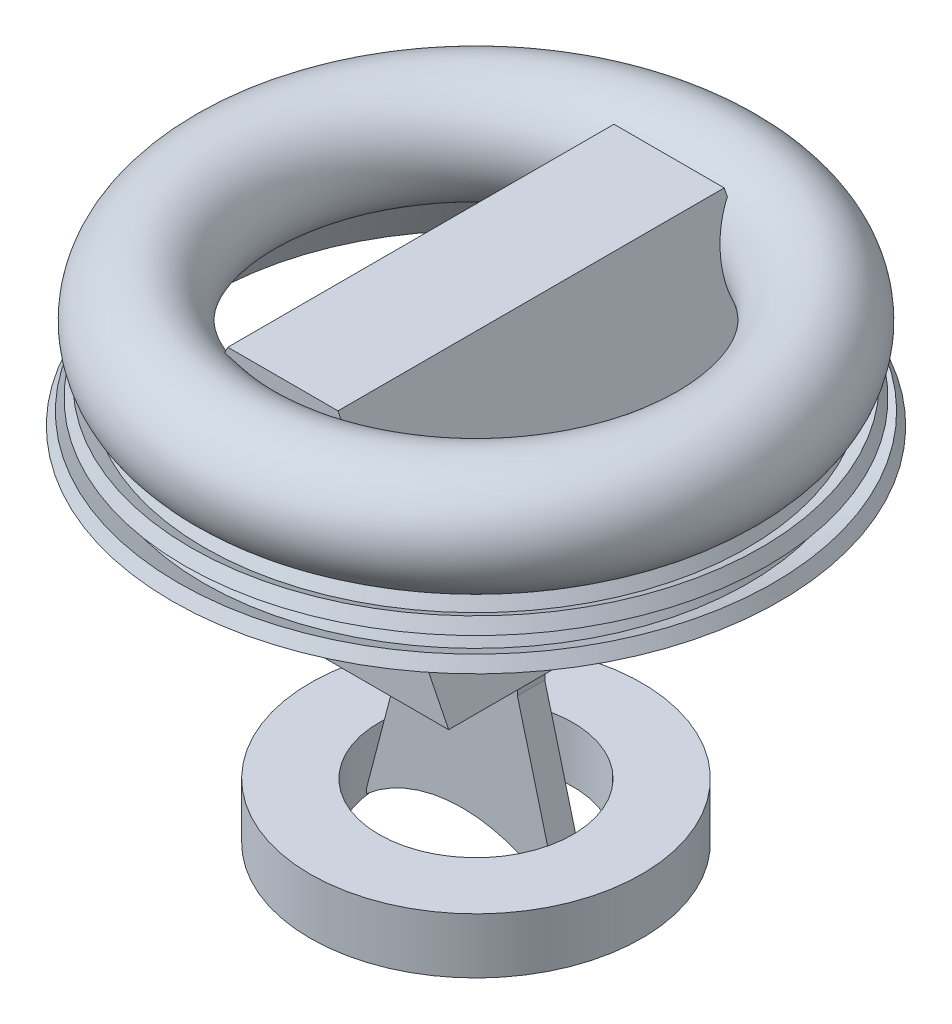
from build123d import *

# Parameters (mm, degrees)
CROQUIS1_R              = 200
CROQUIS1_R_2            = 117
SALIENTE_EXTRUIR1_DEPTH = 67
SALIENTE_EXTRUIR2_DEPTH = 233
SALIENTE_EXTRUIR7_DEPTH = 16.5
CROQUIS7_R              = 50


with BuildPart() as part:
    # Croquis1 → Saliente-Extruir1 (new body)
    with BuildSketch(Plane(origin=(0, 0, 0), x_dir=(1, 0, 0), z_dir=(0, 1, 0))):
        with Locations(Location((0, 0, 0), (0, 0, 270))):
            Circle(CROQUIS1_R)
        with Locations(Location((0, 0, 0), (0, 0, 270))):
            Circle(CROQUIS1_R_2, mode=Mode.SUBTRACT)
    extrude(amount=SALIENTE_EXTRUIR1_DEPTH)



with BuildPart() as body_2:
    # Croquis3 → Saliente-Extruir2 (new, symmetric)
    with BuildSketch(Plane.XY):
        Polygon((-66.5, 601), (66.5, 601), (200, 334.575995826), (-200, 334.575995826), align=None)
    extrude(amount=SALIENTE_EXTRUIR2_DEPTH, both=True)


with BuildPart() as part_1:
    add(part.part)

    add(body_2.part)  # Saliente-Extruir7 merges body 2
    # Croquis2 → Saliente-Extruir7 (add, symmetric)
    with BuildSketch(Plane.XY):
        with BuildLine():
            ThreePointArc((117.53515625, 0), (0, 44.65768989), (-117.53515625, 0))
            Line((-117.53515625, 0), (-66.5, 195))
            Line((-66.5, 195), (-66.5, 334.58))
            Line((-66.5, 334.58), (-16.5, 434.58))
            Line((-16.5, 434.58), (16.5, 434.58))
            Line((16.5, 434.58), (66.5, 334.58))
            Line((66.5, 334.58), (66.5, 195))
            Line((66.5, 195), (117.53515625, 0))
        make_face()
    extrude(amount=SALIENTE_EXTRUIR7_DEPTH, both=True)

    # Croquis7 → Revolución1 (revolve)
    with BuildSketch(Plane.XY, mode=Mode.PRIVATE) as revoluci_n1_sk:
        with BuildLine():
            Line((-328.568002885, 435.320923068), (-358.915723247, 450.783858927))
            Line((-358.915723247, 450.783858927), (-366.633561742, 435.636748015))
            Line((-366.633561742, 435.636748015), (-321.192229009, 412.483232529))
            Line((-321.192229009, 412.483232529), (-286.70426073, 479.581718611))
            ThreePointArc((-286.70426073, 479.581718611), (-276.083484596, 611.027537236), (-320.190368233, 486.748066141))
            Line((-320.190368233, 486.748066141), (-327.682577647, 472.043777236))
            Line((-327.682577647, 472.043777236), (-343.934036755, 480.187074225))
            Line((-343.934036755, 480.187074225), (-351.550069654, 464.987868376))
            Line((-351.550069654, 464.987868376), (-321.298172251, 449.829218104))
            Line((-321.298172251, 449.829218104), (-328.568002885, 435.320923068))
        make_face()
        with Locations((-290, 546)):
            Circle(CROQUIS7_R, mode=Mode.SUBTRACT)
    revolve(revoluci_n1_sk.sketch.rotate(Axis((0, 634.361648219, 0), (0, -1, 0)), 270), axis=Axis((0, 634.361648219, 0), (0, -1, 0)))


solid = part_1.part
